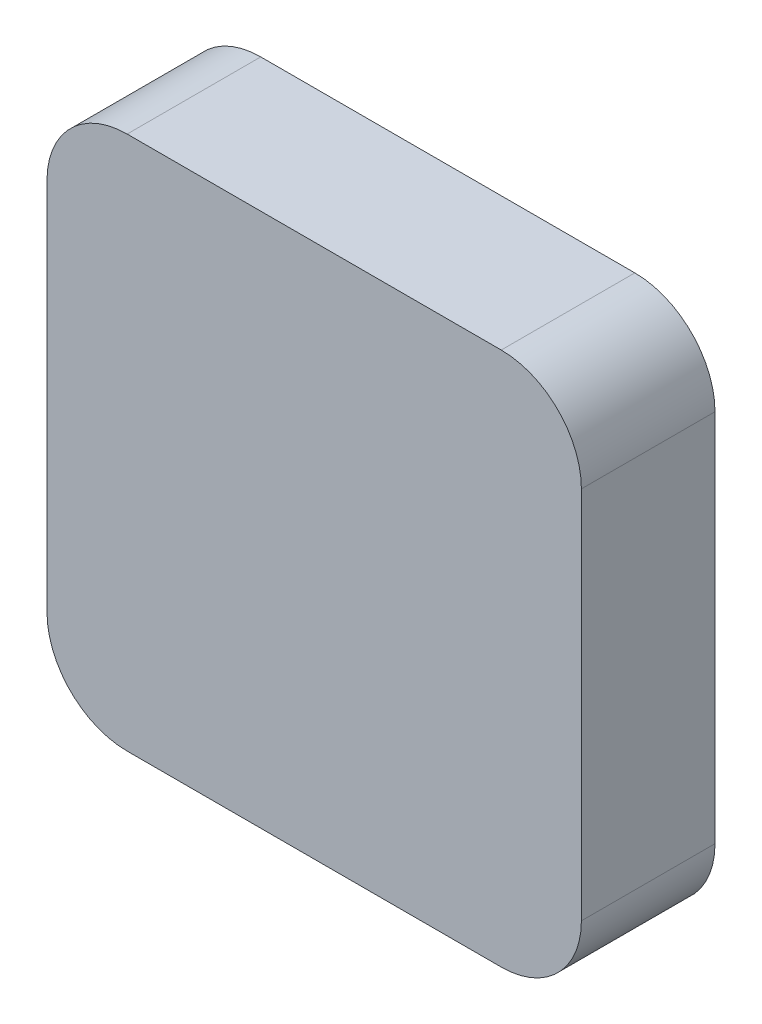
from build123d import *

# Parameters (mm, degrees)
SKETCH1_W           = 20
SKETCH1_H           = 20
BOSS_EXTRUDE1_DEPTH = 2.5
FILLET1_R           = 3


with BuildPart() as part:
    # Sketch1 → Boss-Extrude1 (new, symmetric)
    with BuildSketch(Plane.XY):
        Rectangle(SKETCH1_W, SKETCH1_H)
    extrude(amount=BOSS_EXTRUDE1_DEPTH, both=True)

    # Fillet1
    fillet1_edges = [part.edges().sort_by_distance(p)[0] for p in [
        (10, -10, 0),
        (-10, -10, 0),
        (-10, 10, 0),
        (10, 10, 0),
    ]]
    fillet(fillet1_edges, radius=FILLET1_R)


solid = part.part
